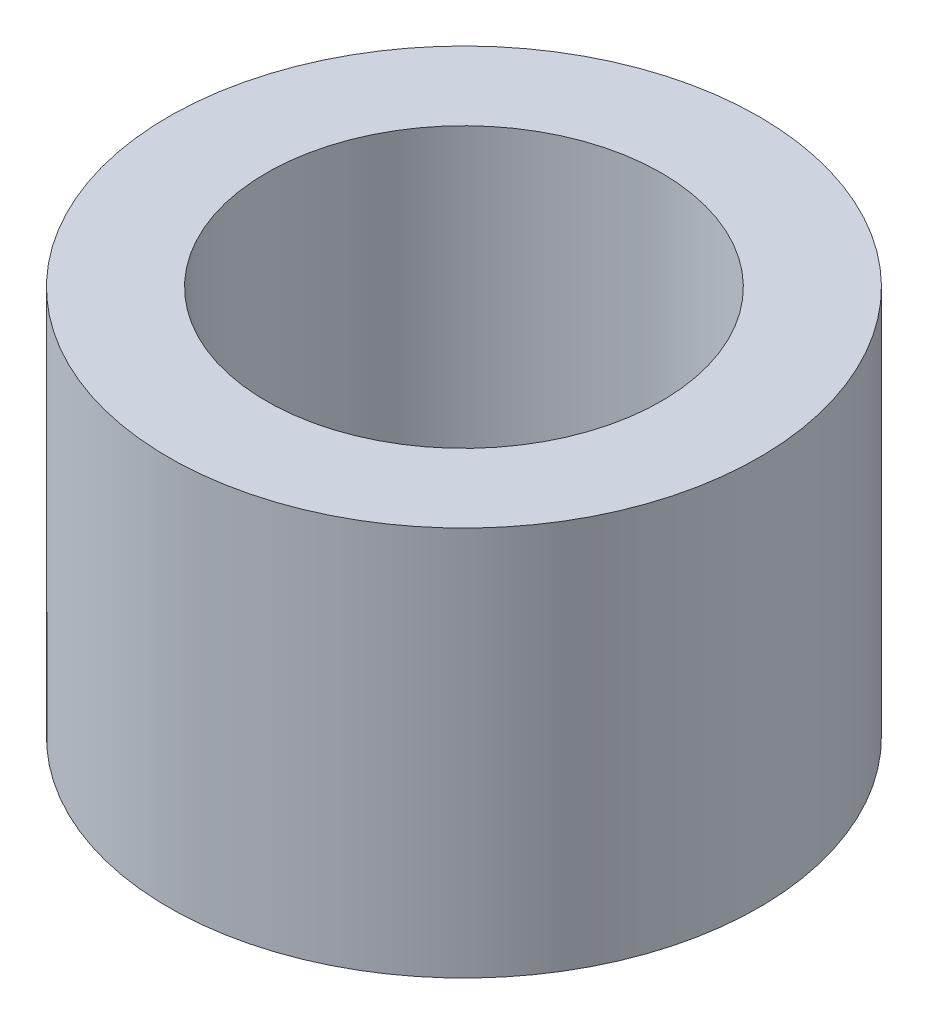
from build123d import *

# Parameters (mm, degrees)
SKETCH1_R           = 6.35
SKETCH1_R_2         = 4.25
BOSS_EXTRUDE1_DEPTH = 8.382


with BuildPart() as part:
    # Sketch1 → Boss-Extrude1 (new body)
    with BuildSketch(Plane(origin=(0, 0, 0), x_dir=(1, 0, 0), z_dir=(0, 1, 0))):
        with Locations(Location((0, 0, 0), (0, 0, 90))):
            Circle(SKETCH1_R)
        with Locations(Location((0, 0, 0), (0, 0, 90))):
            Circle(SKETCH1_R_2, mode=Mode.SUBTRACT)
    extrude(amount=BOSS_EXTRUDE1_DEPTH)


solid = part.part
